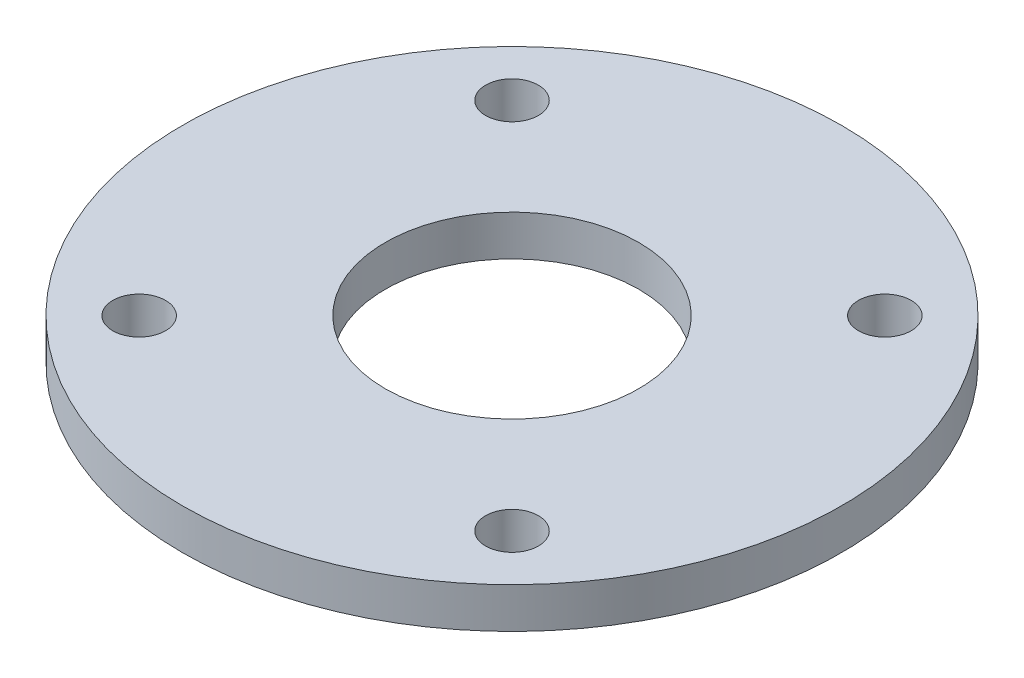
from build123d import *

# Parameters (mm, degrees)
SKETCH1_R           = 32.5
SKETCH1_R_2         = 12.5
SKETCH1_R_3         = 2.6
BOSS_EXTRUDE1_DEPTH = 4


with BuildPart() as part:
    # Sketch1 → Boss-Extrude1 (new body)
    with BuildSketch(Plane(origin=(0, 0, 0), x_dir=(1, 0, 0), z_dir=(0, 1, 0))):
        with Locations(Location((0, 0, 0), (0, 0, 270))):
            Circle(SKETCH1_R)
        with Locations(Location((0, 0, 0), (0, 0, 270))):
            Circle(SKETCH1_R_2, mode=Mode.SUBTRACT)
        with Locations(Location((18.384776311, -18.384776311, 0), (0, 0, 270))):
            Circle(SKETCH1_R_3, mode=Mode.SUBTRACT)
        with Locations(Location((-18.384776311, -18.384776311, 0), (0, 0, 270))):
            Circle(SKETCH1_R_3, mode=Mode.SUBTRACT)
        with Locations(Location((-18.384776311, 18.384776311, 0), (0, 0, 270))):
            Circle(SKETCH1_R_3, mode=Mode.SUBTRACT)
        with Locations(Location((18.384776311, 18.384776311, 0), (0, 0, 270))):
            Circle(SKETCH1_R_3, mode=Mode.SUBTRACT)
    extrude(amount=BOSS_EXTRUDE1_DEPTH)


solid = part.part
